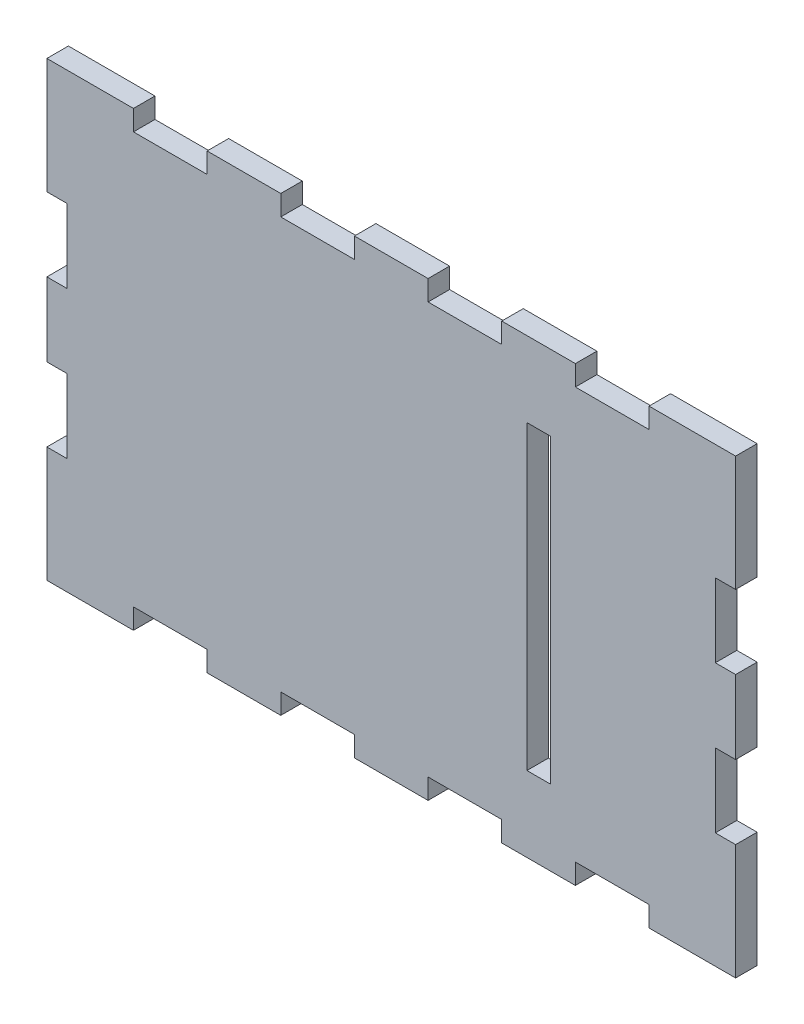
from build123d import *

# Parameters (mm, degrees)
BOSS_EXTRUDE1_DEPTH = 6.35
SKETCH4_W           = 6.888524177
SKETCH4_H           = 88.9
CUT_EXTRUDE1_DEPTH  = 6.35


with BuildPart() as part:
    # Sketch3 → Boss-Extrude1 (new body)
    with BuildSketch(Plane.XY):
        Polygon((0, 77.53985), (0, 55.81015), (5.9944, 55.81015), (5.9944, 34.08045), (0, 34.08045), (0, 12.35075), (0, 0), (25.54605, 0), (25.54605, 5.9944), (47.27575, 5.9944), (47.27575, 0), (69.00545, 0), (69.00545, 5.9944), (90.73515, 5.9944), (90.73515, 0), (112.46485, 0), (112.46485, 5.9944), (134.19455, 5.9944), (134.19455, 0), (155.92425, 0), (155.92425, 5.9944), (177.65395, 5.9944), (177.65395, 0), (203.2, 0), (203.2, 34.08045), (197.2056, 34.08045), (197.2056, 55.81015), (203.2, 55.81015), (203.2, 77.53985), (197.2056, 77.53985), (197.2056, 99.26955), (203.2, 99.26955), (203.2, 120.99925), (203.2, 133.35), (177.65395, 133.35), (177.65395, 127.3556), (155.92425, 127.3556), (155.92425, 133.35), (134.19455, 133.35), (134.19455, 127.3556), (112.46485, 127.3556), (112.46485, 133.35), (90.73515, 133.35), (90.73515, 127.3556), (69.00545, 127.3556), (69.00545, 133.35), (47.27575, 133.35), (47.27575, 127.3556), (25.54605, 127.3556), (25.54605, 133.35), (0, 133.35), (0, 99.26955), (5.9944, 99.26955), (5.9944, 77.53985), align=None)
    extrude(amount=BOSS_EXTRUDE1_DEPTH)

    # Sketch4 → Cut-Extrude1 (cut)
    with BuildSketch(Plane.XY.offset(6.35)):
        with Locations((145.073671488, 66.675)):
            Rectangle(SKETCH4_W, SKETCH4_H)
    extrude(amount=-CUT_EXTRUDE1_DEPTH, mode=Mode.SUBTRACT)


solid = part.part
